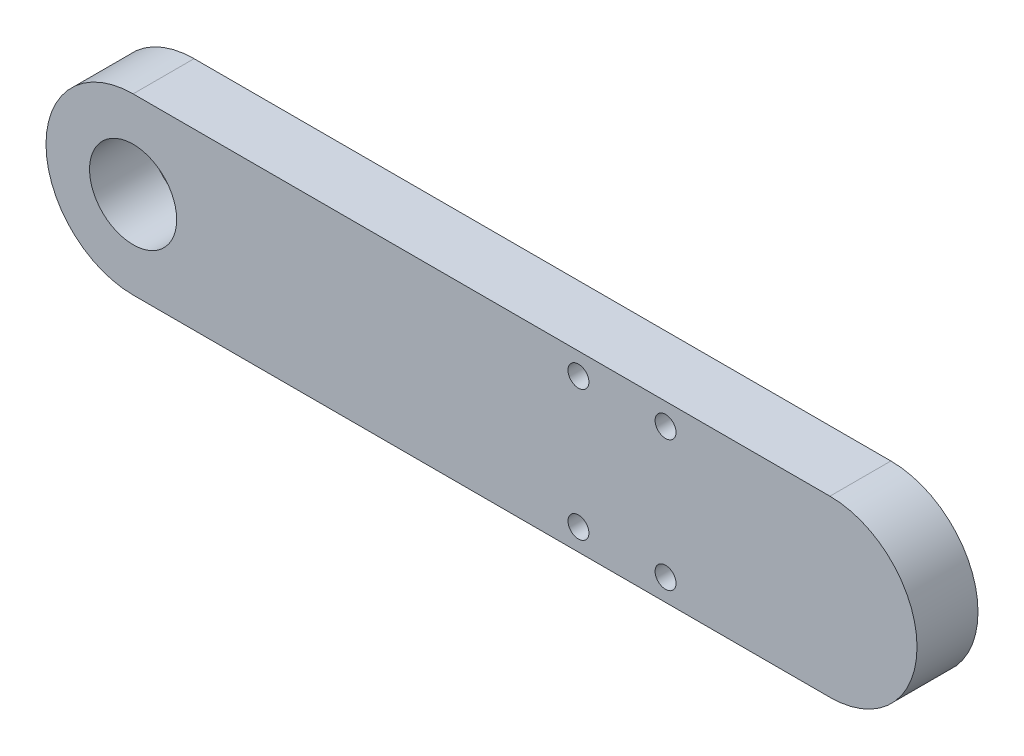
from build123d import *

# Parameters (mm, degrees)
SKETCH_1_R          = 10
SKETCH_1_R_2        = 5
EXTRUDE_1_DEPTH     = 7
SKETCH_2_R          = 1.2
CUT_EXTRUDE_1_DEPTH = 10


with BuildPart() as part:
    # 草图1 → 凸台-拉伸1 (new body)
    # profile 1 of 2: a face of its own
    with BuildSketch(Plane.XY):
        Circle(SKETCH_1_R)
        Circle(SKETCH_1_R_2, mode=Mode.SUBTRACT)
    # profile 2 of 2: a face of its own
    with BuildSketch(Plane.XY):
        with BuildLine():
            Line((80, 10), (0, 10))
            ThreePointArc((0, 10), (7.071067812, 7.071067812), (10, 0))
            ThreePointArc((10, 0), (7.071067812, -7.071067812), (0, -10))
            Line((0, -10), (80, -10))
            ThreePointArc((80, -10), (90, 0), (80, 10))
        make_face()
    extrude(amount=EXTRUDE_1_DEPTH)

    # 草图2 → 切除-拉伸1 (cut)
    with BuildSketch(Plane(origin=(0, 0, 0), x_dir=(-1, 0, 0), z_dir=(0, 0, -1))):
        with Locations((-51.129038153, -7.5)):
            Circle(SKETCH_2_R)
        with Locations((-61.129038153, -7.5)):
            Circle(SKETCH_2_R)
        with Locations((-61.129038153, 7.5)):
            Circle(SKETCH_2_R)
        with Locations((-51.129038153, 7.5)):
            Circle(SKETCH_2_R)
    extrude(amount=-CUT_EXTRUDE_1_DEPTH, mode=Mode.SUBTRACT)


solid = part.part
